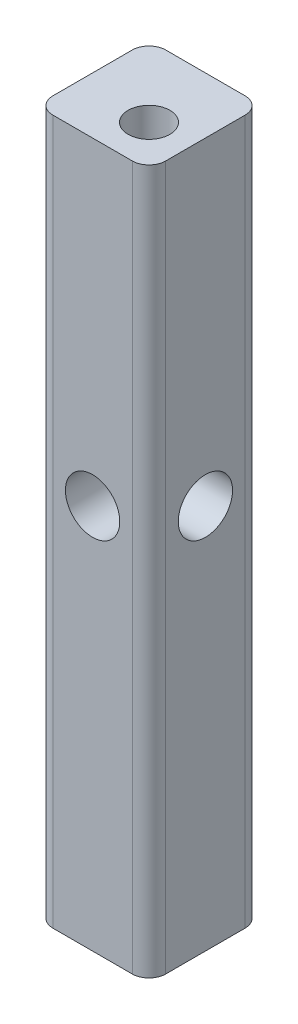
from build123d import *

# Parameters (mm, degrees)
SKETCH4_W           = 13.5
SKETCH4_H           = 13.5
SKETCH4_R           = 2.5
HOLE_TOPMAIN_DEPTH  = 64.27
SKETCH12_R          = 2.5
HOLE_SIDE1_DEPTH    = 67.220336
SKETCH13_R          = 3.25
HOLE_SIDE2_DEPTH    = 66.384500568
SKETCH14_R          = 2.5
CUT_EXTRUDE9_DEPTH  = 67.220336097
SKETCH15_R          = 3.25
CUT_EXTRUDE10_DEPTH = 66.384500581
FILLET3_R           = 2
BOSS_EXTRUDE2_START = 20
SKETCH17_R          = 2.5
BOSS_EXTRUDE2_DEPTH = 20


with BuildPart() as part:
    # Sketch4 → hole-TopMain (new body)
    with BuildSketch(Plane(origin=(0, 0, 0), x_dir=(1, 0, 0), z_dir=(0, 1, 0))):
        with Locations((-1.75, 1.75)):
            Rectangle(SKETCH4_W, SKETCH4_H)
        with Locations(Location((0, 0, 0), (0, 0, 90))):
            Circle(SKETCH4_R, mode=Mode.SUBTRACT)
    extrude(amount=HOLE_TOPMAIN_DEPTH)

    # Sketch12 → hole-Side1 (cut, through all)
    with BuildSketch(Plane(origin=(5, 0, 0), x_dir=(0, 0, -1), z_dir=(1, 0, 0))):
        with Locations((1.75, 46.135)):
            Circle(SKETCH12_R)
    extrude(amount=-HOLE_SIDE1_DEPTH, mode=Mode.SUBTRACT)

    # Sketch13 → hole-Side2 (cut, through all)
    with BuildSketch(Plane.ZY.offset(3.5)):
        with Locations((-1.75, 46.135)):
            Circle(SKETCH13_R)
    extrude(amount=-HOLE_SIDE2_DEPTH, mode=Mode.SUBTRACT)

    # Sketch14 → Cut-Extrude9 (cut, through all)
    with BuildSketch(Plane(origin=(0, 0, -8.5), x_dir=(-1, 0, 0), z_dir=(0, 0, -1))):
        with Locations((1.75, 46.135)):
            Circle(SKETCH14_R)
    extrude(amount=-CUT_EXTRUDE9_DEPTH, mode=Mode.SUBTRACT)

    # Sketch15 → Cut-Extrude10 (cut, through all)
    with BuildSketch(Plane(origin=(0, 0, -3.5), x_dir=(-1, 0, 0), z_dir=(0, 0, -1))):
        with Locations((1.75, 46.135)):
            Circle(SKETCH15_R)
    extrude(amount=-CUT_EXTRUDE10_DEPTH, mode=Mode.SUBTRACT)

    # Fillet3
    fillet3_edges = [part.edges().sort_by_distance(p)[0] for p in [
        (-8.5, 32.135, -8.5),
        (-8.5, 32.135, 5),
        (5, 32.135, 5),
        (5, 32.135, -8.5),
    ]]
    fillet(fillet3_edges, radius=FILLET3_R)

    # Sketch17 → Boss-Extrude2 (add)
    with BuildSketch(Plane(origin=(0, 64.27, 0), x_dir=(1, 0, 0), z_dir=(0, 1, 0)).offset(BOSS_EXTRUDE2_START)):
        with BuildLine():
            Line((-8.5, 6.5), (-8.5, -3))
            ThreePointArc((-8.5, -3), (-7.914213562, -4.414213562), (-6.5, -5))
            Line((-6.5, -5), (3, -5))
            ThreePointArc((3, -5), (4.414213562, -4.414213562), (5, -3))
            Line((5, -3), (5, 6.5))
            ThreePointArc((5, 6.5), (4.414213562, 7.914213562), (3, 8.5))
            Line((3, 8.5), (-6.5, 8.5))
            ThreePointArc((-6.5, 8.5), (-7.914213562, 7.914213562), (-8.5, 6.5))
        make_face()
        with Locations(Location((0, 0, 0), (0, 0, 270))):
            Circle(SKETCH17_R, mode=Mode.SUBTRACT)
    extrude(amount=-BOSS_EXTRUDE2_DEPTH)


solid = part.part
